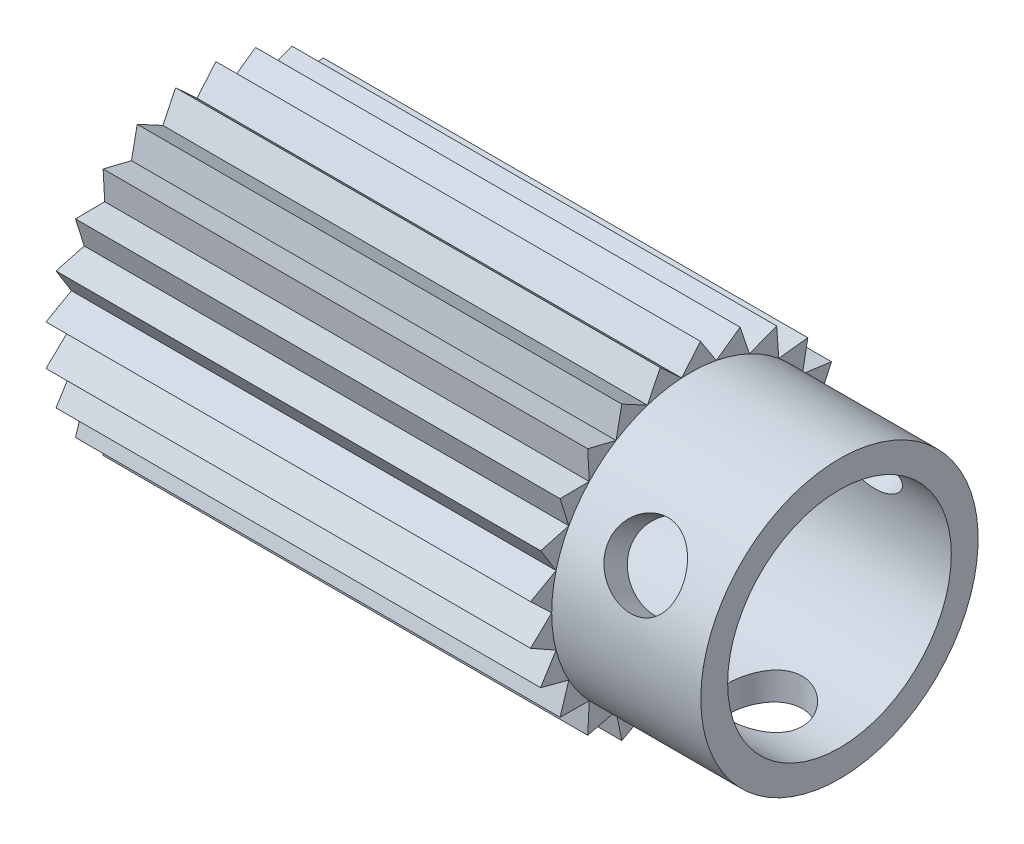
from build123d import *

# Parameters (mm, degrees)
SKETCH2_R          = 3.175
CUT_EXTRUDE1_DEPTH = 38.600633721
CIRPATTERN1_COUNT  = 3
SKETCH3_R          = 15.875
CUT_EXTRUDE2_DEPTH = 59.457949723


with BuildPart() as part:
    # Sketch1 → Revolve1 (revolve)
    with BuildSketch(Plane(origin=(0, 0, 0), x_dir=(1, 0, 0), z_dir=(0, 1, 0))):
        Polygon((-30.1625, -15.875), (-30.1625, -6.35), (-23.8125, -6.35), (-23.8125, -9.525), (23.8125, -9.525), (23.8125, -11.811), (11.1125, -11.811), (11.1125, -15.875), align=None)
    revolve(axis=Axis((-42.066572288, 0, 0), (1, 0, 0)))

    # Sketch2 → Cut-Extrude1 (cut, through all)
    with BuildSketch(Plane(origin=(0, 0, 0), x_dir=(1, 0, 0), z_dir=(0, 1, 0))):
        with Locations(Location((17.4625, 0, 0), (0, 0, 270))):
            Circle(SKETCH2_R)
    cut_extrude1 = extrude(amount=-CUT_EXTRUDE1_DEPTH, mode=Mode.SUBTRACT)

    # CirPattern1: Cut-Extrude1 ×3 about axis
    cirpattern1_axis = Axis((-42.066572288, 0, 0), (1, 0, 0))
    for i in range(1, CIRPATTERN1_COUNT):
        add(cut_extrude1.rotate(cirpattern1_axis, i * 360 / CIRPATTERN1_COUNT), mode=Mode.SUBTRACT)

    # Sketch3 → Cut-Extrude2 (cut, through all)
    with BuildSketch(Plane.ZY.offset(30.1625)):
        Circle(SKETCH3_R)
        Polygon((13.607845243, 1.719070632), (11.811, 0), (13.607845243, -1.719070632), (11.439935716, -2.937276257), (12.75281428, -5.049196365), (10.350058198, -5.689992645), (11.096477095, -8.06206252), (8.609848458, -8.085185868), (8.742907443, -10.568359638), (6.328650275, -9.972357128), (5.839988763, -12.410607852), (3.649799721, -11.232928514), (2.570122111, -13.473051931), (0.741618826, -11.787693689), (-0.861234766, -13.688934607), (-2.213160707, -11.601794718), (-4.238477095, -13.044691178), (-5.028879213, -10.686912317), (-7.34940032, -11.580801826), (-7.528614743, -9.10053191), (-9.998533694, -9.389248105), (-9.555299721, -6.942331615), (-12.019422423, -6.607733394), (-10.981590075, -4.347919092), (-13.285086638, -3.411030492), (-11.717866737, -1.480310822), (-13.716, 0), (-11.717866737, 1.480310822), (-13.285086638, 3.411030492), (-10.981590075, 4.347919092), (-12.019422423, 6.607733394), (-9.555299721, 6.942331615), (-9.998533694, 9.389248105), (-7.528614743, 9.10053191), (-7.34940032, 11.580801826), (-5.028879213, 10.686912317), (-4.238477095, 13.044691178), (-2.213160707, 11.601794718), (-0.861234766, 13.688934607), (0.741618826, 11.787693689), (2.570122111, 13.473051931), (3.649799721, 11.232928514), (5.839988763, 12.410607852), (6.328650275, 9.972357128), (8.742907443, 10.568359638), (8.609848458, 8.085185868), (11.096477095, 8.06206252), (10.350058198, 5.689992645), (12.75281428, 5.049196365), (11.439935716, 2.937276257), align=None, mode=Mode.SUBTRACT)
    extrude(amount=-CUT_EXTRUDE2_DEPTH, mode=Mode.SUBTRACT)


solid = part.part
